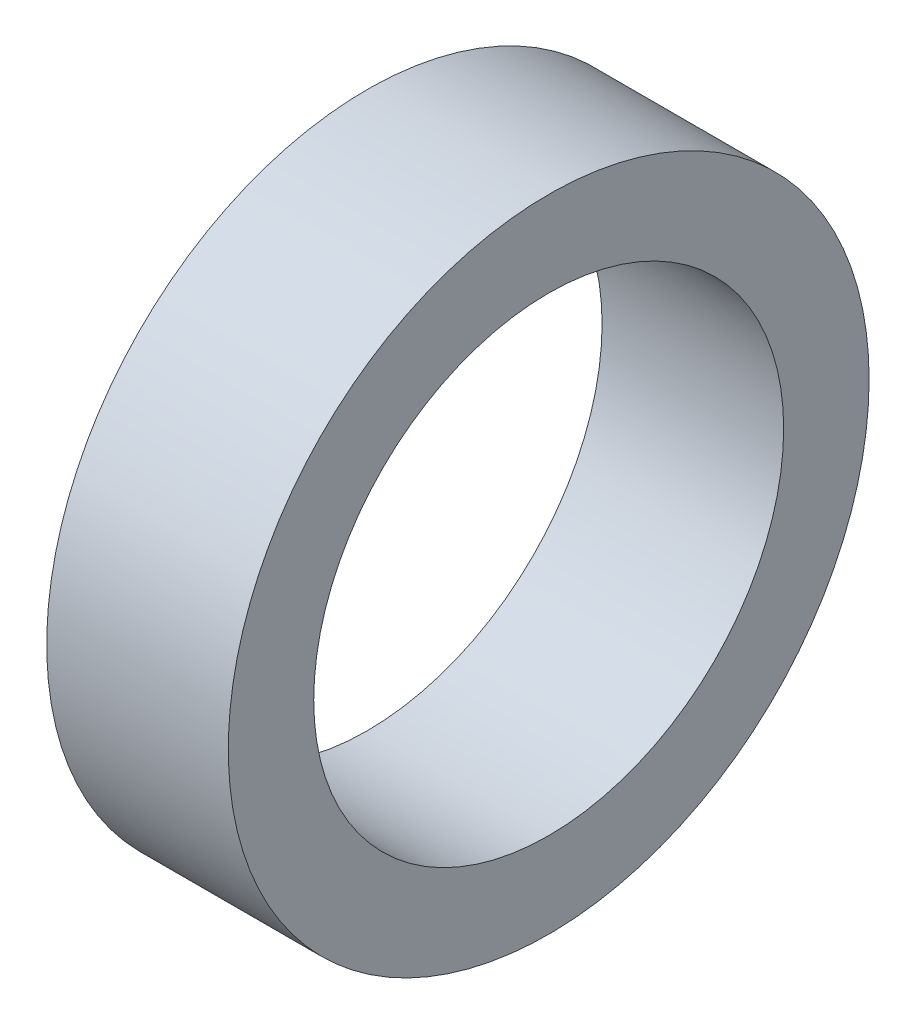
from build123d import *

# Parameters (mm, degrees)
SKETCH_1_W = 34
SKETCH_1_H = 16


with BuildPart() as part:
    # Эскиз1 → Повернуть1 (revolve)
    with BuildSketch(Plane.XY, mode=Mode.PRIVATE) as revolve_1_sk:
        with Locations((-17, 52)):
            Rectangle(SKETCH_1_W, SKETCH_1_H)
    revolve(revolve_1_sk.sketch.rotate(Axis((-34, 0, 0), (1, 0, 0)), 270), axis=Axis((-34, 0, 0), (1, 0, 0)))


solid = part.part
